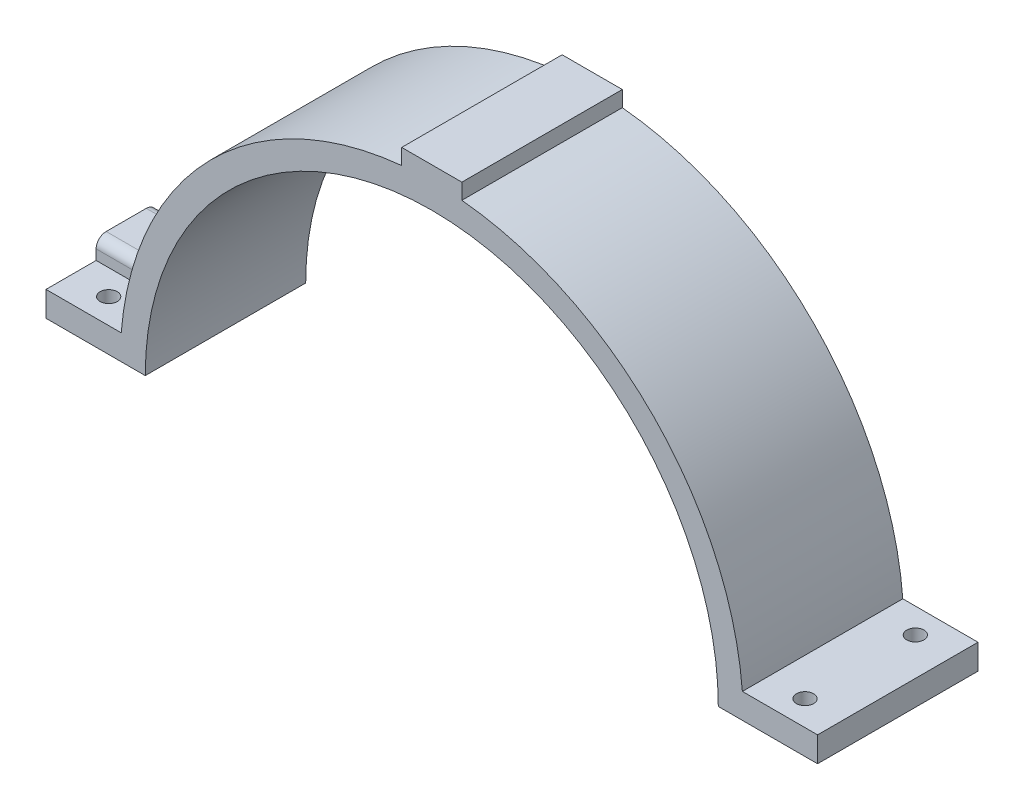
from build123d import *

# Parameters (mm, degrees)
EXTRUDE_1_DEPTH     = 32
SKETCH_2_W          = 12
SKETCH_2_H          = 3.140299871
SKETCH_2_W_2        = 15
SKETCH_2_H_2        = 5
EXTRUDE_2_DEPTH     = 32
SKETCH_3_W          = 12
SKETCH_3_H          = 9
EXTRUDE_3_DEPTH     = 19
CUT_EXTRUDE_1_DEPTH = 15
FILLET_1_R          = 2
CUT_EXTRUDE_2_REACH = 104.689
SKETCH_5_R          = 1.711419382


with BuildPart() as part:
    # ｽｹｯﾁ1 → ﾎﾞｽ - 押し出し1 (new body)
    with BuildSketch(Plane.XY):
        with BuildLine():
            Line((-57.15, 0), (-62.15, 0))
            ThreePointArc((-62.15, 0), (0, 62.15), (62.15, 0))
            Line((62.15, 0), (57.15, 0))
            ThreePointArc((57.15, 0), (0, 57.15), (-57.15, 0))
        make_face()
    extrude(amount=EXTRUDE_1_DEPTH)

    # ｽｹｯﾁ2 → ﾎﾞｽ - 押し出し2 (add)
    with BuildSketch(Plane.XY.offset(32)):
        with Locations((0, 63.429850065)):
            Rectangle(SKETCH_2_W, SKETCH_2_H)
        with Locations((69.448547198, 2.5)):
            Rectangle(SKETCH_2_W_2, SKETCH_2_H_2)
        with Locations((-69.448547198, 2.5)):
            Rectangle(SKETCH_2_W_2, SKETCH_2_H_2)
    extrude(amount=-EXTRUDE_2_DEPTH)

    # ｽｹｯﾁ3 → ﾎﾞｽ - 押し出し3 (add)
    with BuildSketch(Plane.ZY.offset(76.948547198)):
        with Locations((16, 4.5)):
            Rectangle(SKETCH_3_W, SKETCH_3_H)
    extrude(amount=-EXTRUDE_3_DEPTH)

    # ｽｹｯﾁ4 → ｶｯﾄ - 押し出し1 (cut)
    with BuildSketch(Plane.ZY.offset(76.948547198)):
        with BuildLine():
            Line((10, 0), (22, 0))
            ThreePointArc((22, 0), (16, 6), (10, 0))
        make_face()
    extrude(amount=-CUT_EXTRUDE_1_DEPTH, mode=Mode.SUBTRACT)

    # ﾌｨﾚｯﾄ1
    fillet_1_edges = [part.edges().sort_by_distance(p)[0] for p in [
        (-69.22172268, 9, 10),
        (-69.22172268, 9, 22),
    ]]
    fillet(fillet_1_edges, radius=FILLET_1_R)

    # ｽｹｯﾁ5 → ｶｯﾄ - 押し出し2 (cut, up to next)
    with BuildSketch(Plane(origin=(0, 5, 0), x_dir=(1, 0, 0), z_dir=(0, 1, 0)), mode=Mode.PRIVATE) as cut_extrude_2_sk1:
        with Locations(Location((-69.448547198, -5, 0), (0, 0, 180))):
            Circle(SKETCH_5_R)
    cut_extrude_2_tool1 = extrude(cut_extrude_2_sk1.sketch, amount=-CUT_EXTRUDE_2_REACH, mode=Mode.PRIVATE) & part.part
    # ｽｹｯﾁ5 → ｶｯﾄ - 押し出し2 (cut, up to next)
    with BuildSketch(Plane(origin=(0, 5, 0), x_dir=(1, 0, 0), z_dir=(0, 1, 0)), mode=Mode.PRIVATE) as cut_extrude_2_sk2:
        with Locations(Location((-69.448547198, -27, 0), (0, 0, 180))):
            Circle(SKETCH_5_R)
    cut_extrude_2_tool2 = extrude(cut_extrude_2_sk2.sketch, amount=-CUT_EXTRUDE_2_REACH, mode=Mode.PRIVATE) & part.part
    # ｽｹｯﾁ5 → ｶｯﾄ - 押し出し2 (cut, up to next)
    with BuildSketch(Plane(origin=(0, 5, 0), x_dir=(1, 0, 0), z_dir=(0, 1, 0)), mode=Mode.PRIVATE) as cut_extrude_2_sk3:
        with Locations(Location((69.448547198, -27, 0), (0, 0, 180))):
            Circle(SKETCH_5_R)
    cut_extrude_2_tool3 = extrude(cut_extrude_2_sk3.sketch, amount=-CUT_EXTRUDE_2_REACH, mode=Mode.PRIVATE) & part.part
    # ｽｹｯﾁ5 → ｶｯﾄ - 押し出し2 (cut, up to next)
    with BuildSketch(Plane(origin=(0, 5, 0), x_dir=(1, 0, 0), z_dir=(0, 1, 0)), mode=Mode.PRIVATE) as cut_extrude_2_sk4:
        with Locations(Location((69.448547198, -5, 0), (0, 0, 180))):
            Circle(SKETCH_5_R)
    cut_extrude_2_tool4 = extrude(cut_extrude_2_sk4.sketch, amount=-CUT_EXTRUDE_2_REACH, mode=Mode.PRIVATE) & part.part
    add(cut_extrude_2_tool1.solids().sort_by_distance((-69.448547, 5, 5))[0], mode=Mode.SUBTRACT)
    add(cut_extrude_2_tool2.solids().sort_by_distance((-69.448547, 5, 27))[0], mode=Mode.SUBTRACT)
    add(cut_extrude_2_tool3.solids().sort_by_distance((69.448547, 5, 27))[0], mode=Mode.SUBTRACT)
    add(cut_extrude_2_tool4.solids().sort_by_distance((69.448547, 5, 5))[0], mode=Mode.SUBTRACT)


solid = part.part
